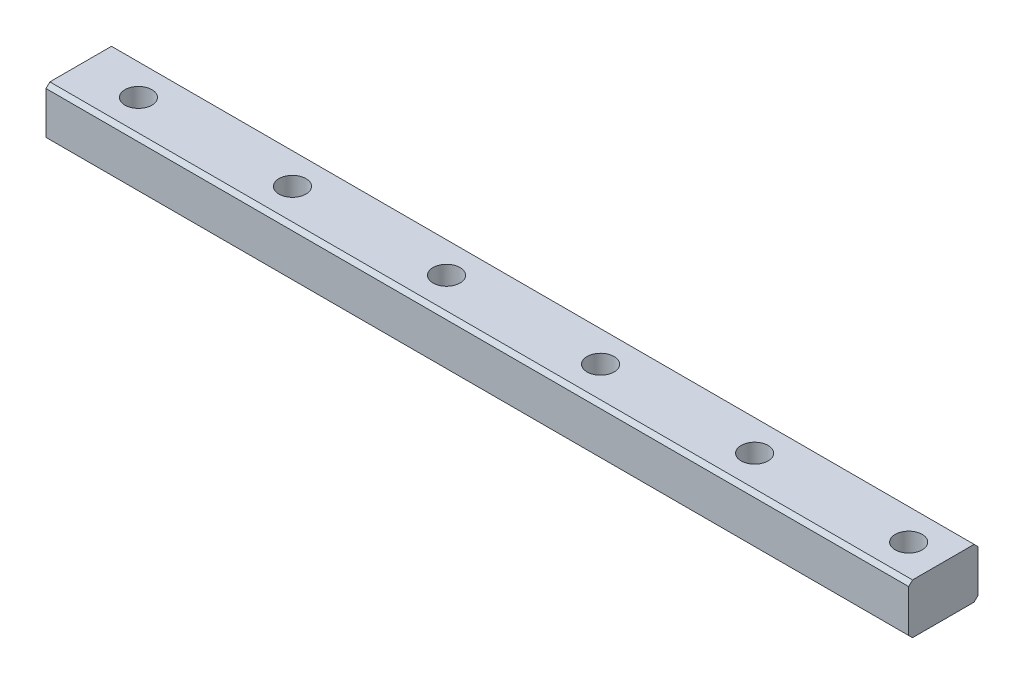
from build123d import *

# Parameters (mm, degrees)
SKETCH_1_W          = 9
SKETCH_1_H          = 6.5
EXTRUDE_1_DEPTH     = 112
SKETCH_2_R          = 1.75
CUT_EXTRUDE_2_DEPTH = 8
SKETCH_3_R          = 3
CUT_EXTRUDE_3_DEPTH = 3.5
CHAMFER_1_SIZE      = 0.5


with BuildPart() as part:
    # 草图1 → 拉伸1 (new body)
    with BuildSketch(Plane(origin=(0, 0, 0), x_dir=(0, 0, -1), z_dir=(1, 0, 0))):
        Rectangle(SKETCH_1_W, SKETCH_1_H)
    extrude(amount=EXTRUDE_1_DEPTH)

    # 草图2 → 拉伸2 (cut)
    with BuildSketch(Plane.XZ.offset(3.25)):
        with Locations(Location((7.5, 0, 0), (0, 0, 270))):
            Circle(SKETCH_2_R)
        with Locations((167.5, 0)):
            Circle(SKETCH_2_R)
        with Locations((187.5, 0)):
            Circle(SKETCH_2_R)
        with Locations((207.5, 0)):
            Circle(SKETCH_2_R)
        with Locations((227.5, 0)):
            Circle(SKETCH_2_R)
        with Locations((247.5, 0)):
            Circle(SKETCH_2_R)
        with Locations((267.5, 0)):
            Circle(SKETCH_2_R)
        with Locations((287.5, 0)):
            Circle(SKETCH_2_R)
        with Locations(Location((27.5, 0, 0), (0, 0, 270))):
            Circle(SKETCH_2_R)
        with Locations(Location((47.5, 0, 0), (0, 0, 270))):
            Circle(SKETCH_2_R)
        with Locations(Location((67.5, 0, 0), (0, 0, 270))):
            Circle(SKETCH_2_R)
        with Locations(Location((87.5, 0, 0), (0, 0, 270))):
            Circle(SKETCH_2_R)
        with Locations(Location((107.5, 0, 0), (0, 0, 270))):
            Circle(SKETCH_2_R)
        with Locations((127.5, 0)):
            Circle(SKETCH_2_R)
        with Locations((147.5, 0)):
            Circle(SKETCH_2_R)
    extrude(amount=-CUT_EXTRUDE_2_DEPTH, mode=Mode.SUBTRACT)

    # 草图3 → 拉伸3 (cut)
    with BuildSketch(Plane.XZ.offset(3.25)):
        with Locations(Location((7.5, 0, 0), (0, 0, 270))):
            Circle(SKETCH_3_R)
        with Locations((167.5, 0)):
            Circle(SKETCH_3_R)
        with Locations((187.5, 0)):
            Circle(SKETCH_3_R)
        with Locations((207.5, 0)):
            Circle(SKETCH_3_R)
        with Locations((227.5, 0)):
            Circle(SKETCH_3_R)
        with Locations((247.5, 0)):
            Circle(SKETCH_3_R)
        with Locations((267.5, 0)):
            Circle(SKETCH_3_R)
        with Locations((287.5, 0)):
            Circle(SKETCH_3_R)
        with Locations(Location((27.5, 0, 0), (0, 0, 270))):
            Circle(SKETCH_3_R)
        with Locations(Location((47.5, 0, 0), (0, 0, 270))):
            Circle(SKETCH_3_R)
        with Locations(Location((67.5, 0, 0), (0, 0, 270))):
            Circle(SKETCH_3_R)
        with Locations(Location((87.5, 0, 0), (0, 0, 270))):
            Circle(SKETCH_3_R)
        with Locations(Location((107.5, 0, 0), (0, 0, 270))):
            Circle(SKETCH_3_R)
        with Locations((127.5, 0)):
            Circle(SKETCH_3_R)
        with Locations((147.5, 0)):
            Circle(SKETCH_3_R)
    extrude(amount=-CUT_EXTRUDE_3_DEPTH, mode=Mode.SUBTRACT)

    # 倒角1
    chamfer_1_edges = [part.edges().sort_by_distance(p)[0] for p in [
        (56, 3.25, 4.5),
        (56, 3.25, -4.5),
        (56, -3.25, -4.5),
        (56, -3.25, 4.5),
    ]]
    chamfer(chamfer_1_edges, length=CHAMFER_1_SIZE)


solid = part.part
